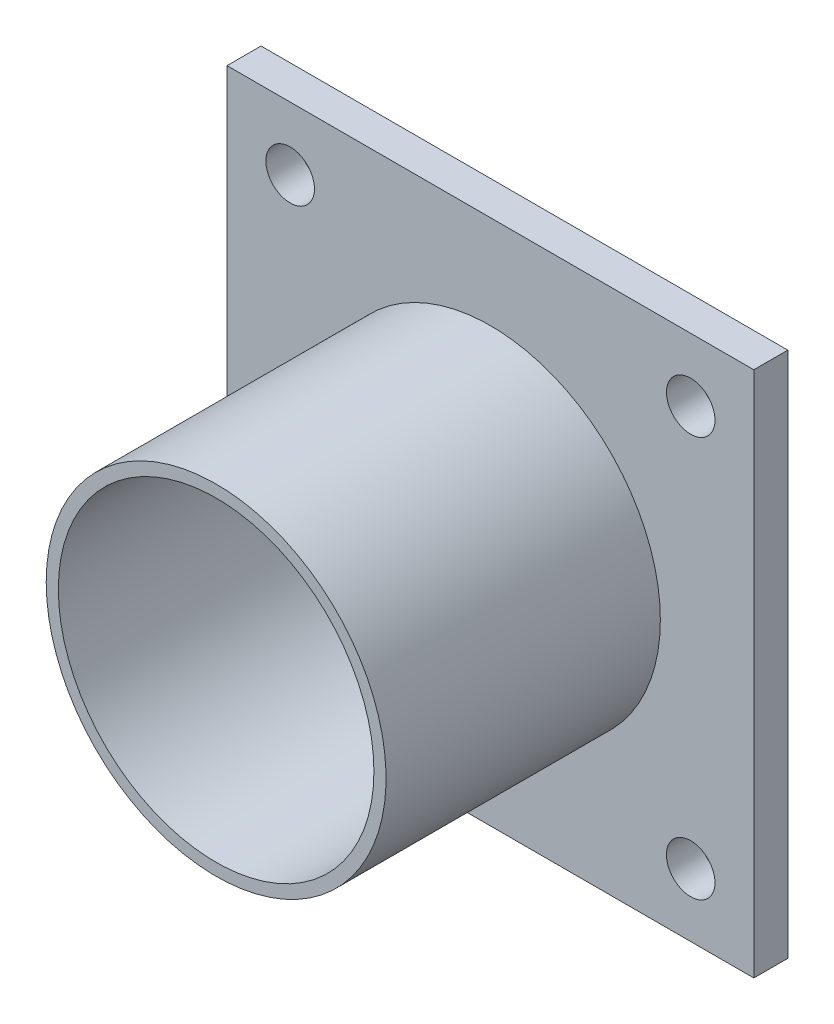
from build123d import *

# Parameters (mm, degrees)
SKETCH_1_W        = 21.7
SKETCH_1_H        = 21.7
SKETCH_1_R        = 1
SKETCH_1_R_2      = 7
EXTRUDE_1_DEPTH   = 1.4
SKETCH_2_R        = 7
SKETCH_2_R_2      = 6.5
EXTRUDE_1_2_DEPTH = 12.7


with BuildPart() as part:
    # Эскиз1 → Extrude 1 (new body)
    with BuildSketch(Plane.XY):
        with Locations((10.85, 10.85)):
            Rectangle(SKETCH_1_W, SKETCH_1_H)
        with Locations((2.6, 19.1)):
            Circle(SKETCH_1_R, mode=Mode.SUBTRACT)
        with Locations((10.85, 10.85)):
            Circle(SKETCH_1_R_2, mode=Mode.SUBTRACT)
        with Locations((19.1, 19.1)):
            Circle(SKETCH_1_R, mode=Mode.SUBTRACT)
        with Locations((19.1, 2.6)):
            Circle(SKETCH_1_R, mode=Mode.SUBTRACT)
        with Locations((2.6, 2.6)):
            Circle(SKETCH_1_R, mode=Mode.SUBTRACT)
    extrude(amount=EXTRUDE_1_DEPTH)

    # Эскиз2 → Extrude 1 2 (add)
    with BuildSketch(Plane(origin=(0, 0, 0), x_dir=(-1, 0, 0), z_dir=(0, 0, -1))):
        with Locations((-10.85, 10.85)):
            Circle(SKETCH_2_R)
        with Locations((-10.85, 10.85)):
            Circle(SKETCH_2_R_2, mode=Mode.SUBTRACT)
    extrude(amount=-EXTRUDE_1_2_DEPTH)


solid = part.part
